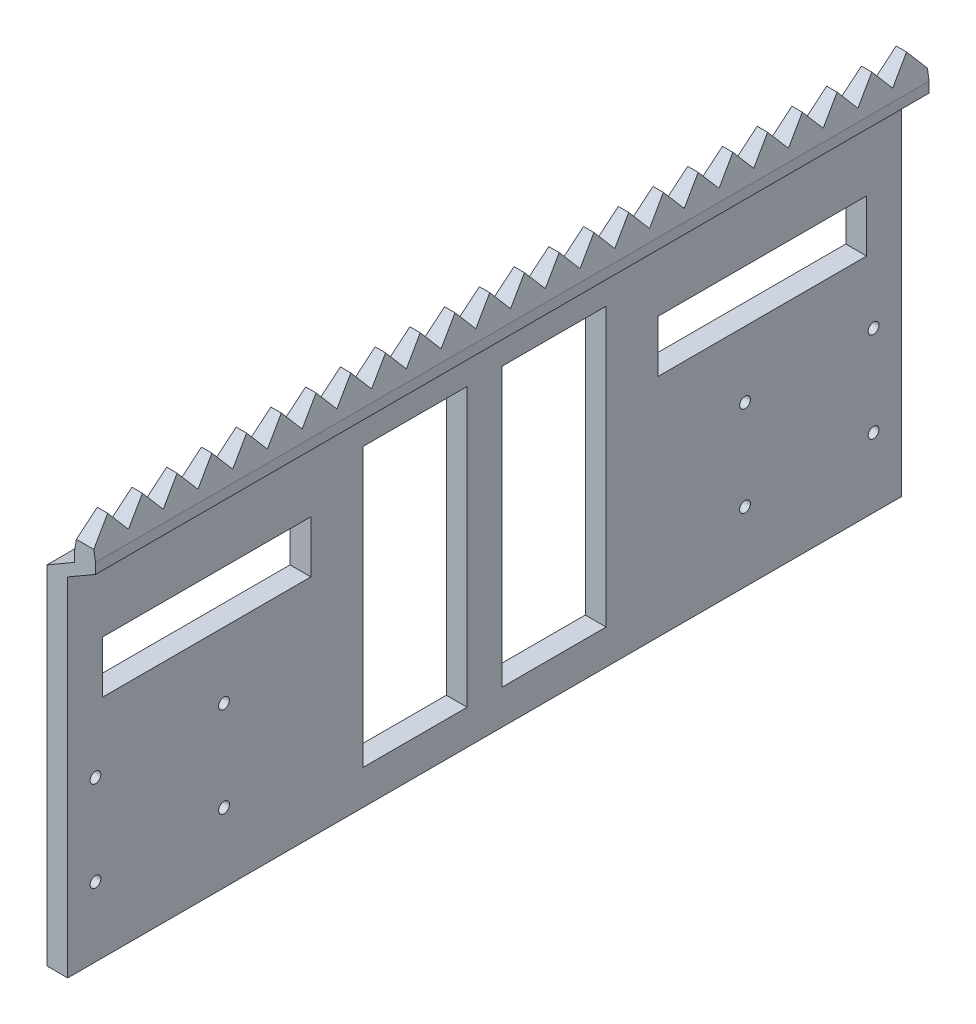
from build123d import *

# Parameters (mm, degrees)
SKETCH_1_W             = 240
SKETCH_1_H             = 100
EXTRUDE_1_DEPTH        = 6
SKETCH_2_R             = 1.55
CUT_EXTRUDE_1_DEPTH    = 261.069221555
SKETCH_3_W             = 60
SKETCH_3_H             = 15
CUT_EXTRUDE_2_DEPTH    = 261.069221555
SKETCH_4_W             = 30
SKETCH_4_H             = 80
CUT_EXTRUDE_3_DEPTH    = 261.069221555
SKETCH_5_R             = 3
CUT_EXTRUDE_4_DEPTH    = 3
EXTRUDE_3_DEPTH        = 240
CUT_EXTRUDE_5_DEPTH    = 10
CUT_EXTRUDE_6_DEPTH    = 10
PATTERN_LINEAR_1_COUNT = 23
PATTERN_LINEAR_1_PITCH = 10
CUT_EXTRUDE_7_DEPTH    = 10
CUT_EXTRUDE_8_DEPTH    = 261.376650259


with BuildPart() as part:
    # 草图1 → 凸台-拉伸1 (new body)
    with BuildSketch(Plane(origin=(0, 0, 0), x_dir=(0, 0, -1), z_dir=(1, 0, 0))):
        with Locations((120, -50)):
            Rectangle(SKETCH_1_W, SKETCH_1_H)
    extrude(amount=EXTRUDE_1_DEPTH)

    # 草图2 → 切除-拉伸1 (cut, through all)
    with BuildSketch(Plane(origin=(6, 0, 0), x_dir=(0, 0, -1), z_dir=(1, 0, 0))):
        with Locations((8, -54)):
            Circle(SKETCH_2_R)
        with Locations((45, -80)):
            Circle(SKETCH_2_R)
        with Locations((45, -54)):
            Circle(SKETCH_2_R)
        with Locations((8, -80)):
            Circle(SKETCH_2_R)
        with Locations(Location((232, -80, 0), (0, 0, 180))):
            Circle(SKETCH_2_R)
        with Locations(Location((195, -54, 0), (0, 0, 180))):
            Circle(SKETCH_2_R)
        with Locations(Location((195, -80, 0), (0, 0, 180))):
            Circle(SKETCH_2_R)
        with Locations(Location((232, -54, 0), (0, 0, 180))):
            Circle(SKETCH_2_R)
    extrude(amount=-CUT_EXTRUDE_1_DEPTH, mode=Mode.SUBTRACT)

    # 草图3 → 切除-拉伸2 (cut, through all)
    with BuildSketch(Plane(origin=(6, 0, 0), x_dir=(0, 0, -1), z_dir=(1, 0, 0))):
        with Locations((40, -27.5)):
            Rectangle(SKETCH_3_W, SKETCH_3_H)
        with Locations((200, -27.5)):
            Rectangle(SKETCH_3_W, SKETCH_3_H)
    extrude(amount=-CUT_EXTRUDE_2_DEPTH, mode=Mode.SUBTRACT)

    # 草图4 → 切除-拉伸3 (cut, through all)
    with BuildSketch(Plane(origin=(6, 0, 0), x_dir=(0, 0, -1), z_dir=(1, 0, 0))):
        with Locations((100, -50)):
            Rectangle(SKETCH_4_W, SKETCH_4_H)
        with Locations((140, -50)):
            Rectangle(SKETCH_4_W, SKETCH_4_H)
    extrude(amount=-CUT_EXTRUDE_3_DEPTH, mode=Mode.SUBTRACT)

    # 草图5 → 切除-拉伸4 (cut)
    with BuildSketch(Plane.ZY):
        with Locations((-195, -80)):
            Circle(SKETCH_5_R)
        with Locations((-232, -80)):
            Circle(SKETCH_5_R)
        with Locations((-195, -54)):
            Circle(SKETCH_5_R)
        with Locations((-232, -54)):
            Circle(SKETCH_5_R)
        with Locations((-45, -80)):
            Circle(SKETCH_5_R)
        with Locations((-8, -80)):
            Circle(SKETCH_5_R)
        with Locations((-8, -54)):
            Circle(SKETCH_5_R)
        with Locations((-45, -54)):
            Circle(SKETCH_5_R)
    extrude(amount=-CUT_EXTRUDE_4_DEPTH, mode=Mode.SUBTRACT)

    # 草图8 → 凸台-拉伸3 (add)
    with BuildSketch(Plane(origin=(0, 0, -240), x_dir=(-1, 0, 0), z_dir=(0, 0, -1))):
        Polygon((-6, 0), (-14, 4.618802154), (-14, 16.618802154), (-8, 16.618802154), (-8, 4.618802154), (0, 0), align=None)
    extrude(amount=-EXTRUDE_3_DEPTH)

    # 草图9 → 切除-拉伸5 (cut)
    with BuildSketch(Plane(origin=(14, 0, 0), x_dir=(0, 0, -1), z_dir=(1, 0, 0))):
        Polygon((0, 16.618802154), (0, 10.618802154), (5, 16.618802154), align=None)
    extrude(amount=-CUT_EXTRUDE_5_DEPTH, mode=Mode.SUBTRACT)

    # 草图10 → 切除-拉伸6 (cut)
    with BuildSketch(Plane(origin=(14, 0, 0), x_dir=(0, 0, -1), z_dir=(1, 0, 0))):
        Polygon((5, 16.618802154), (10, 10.618802154), (15, 16.618802154), align=None)
    cut_extrude_6 = extrude(amount=-CUT_EXTRUDE_6_DEPTH, mode=Mode.SUBTRACT)

    # 阵列(线性)1: 切除-拉伸6 ×23
    with Locations(*[(0, 0, -i * PATTERN_LINEAR_1_PITCH) for i in range(1, PATTERN_LINEAR_1_COUNT)]):
        add(cut_extrude_6, mode=Mode.SUBTRACT)

    # 草图11 → 切除-拉伸7 (cut)
    with BuildSketch(Plane(origin=(14, 0, 0), x_dir=(0, 0, -1), z_dir=(1, 0, 0))):
        Polygon((235, 16.618802154), (240, 10.618802154), (240, 16.618802154), align=None)
    extrude(amount=-CUT_EXTRUDE_7_DEPTH, mode=Mode.SUBTRACT)

    # 草图12 → 切除-拉伸8 (cut, through all)
    with BuildSketch(Plane(origin=(0, 0, -240), x_dir=(-1, 0, 0), z_dir=(0, 0, -1))):
        Polygon((-14, 7.618802154), (-12.5, 16.618802154), (-14, 16.618802154), align=None)
        Polygon((-9.5, 16.618802154), (-8, 7.618802154), (-8, 16.618802154), align=None)
    extrude(amount=-CUT_EXTRUDE_8_DEPTH, mode=Mode.SUBTRACT)


solid = part.part
